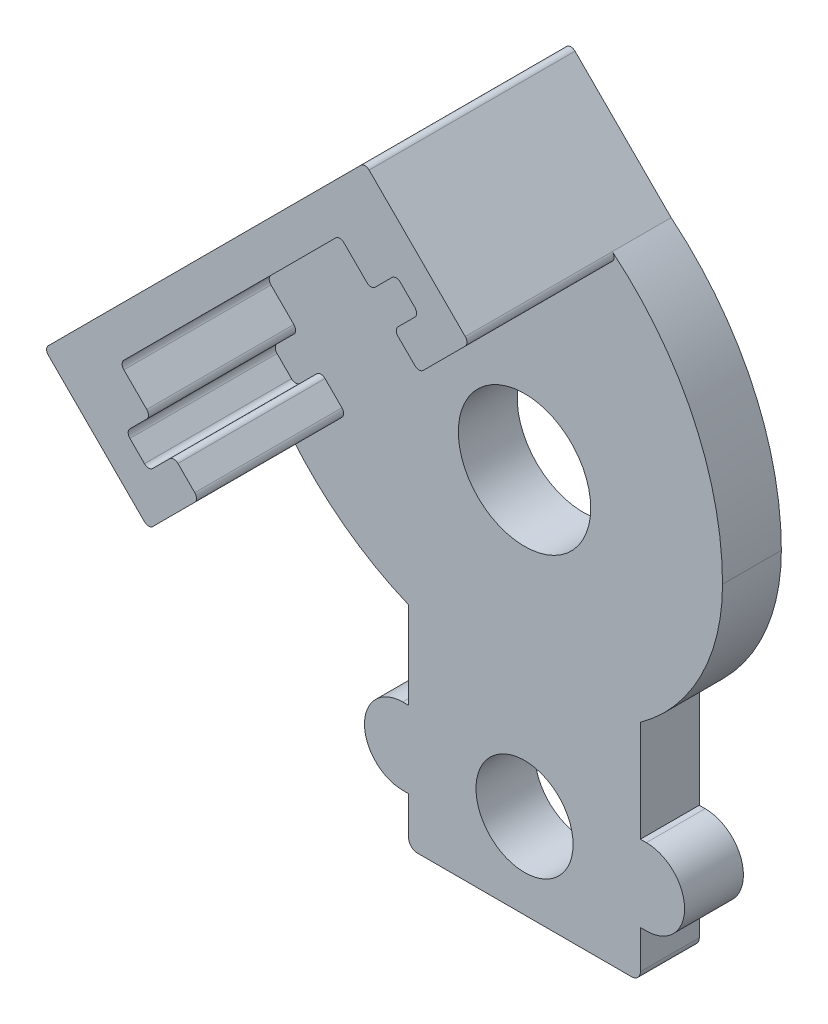
from build123d import *

# Parameters (mm, degrees)
SKETCH1_R           = 2.25
SKETCH1_R_2         = 1.65
BOSS_EXTRUDE1_DEPTH = 2
BOSS_EXTRUDE2_DEPTH = 5


with BuildPart() as part:
    # Sketch1 → Boss-Extrude1 (new body)
    with BuildSketch(Plane.XY):
        with BuildLine():
            Line((-4.14, -8.9), (-3.94, -8.9))
            Line((-3.94, -8.9), (-3.94, -5.942048338))
            ThreePointArc((-3.94, -5.942048338), (-6.111467123, -4.707426407), (-7.919595949, -2.983990617))
            Line((-7.919595949, -2.983990617), (-11.186429278, 0.282842712))
            ThreePointArc((-11.186429278, 0.282842712), (-11.245007922, 0.424264069), (-11.186429278, 0.565685425))
            Line((-11.186429278, 0.565685425), (-0.565685425, 11.186429278))
            ThreePointArc((-0.565685425, 11.186429278), (-0.424264069, 11.245007922), (-0.282842712, 11.186429278))
            Line((-0.282842712, 11.186429278), (2.983990617, 7.919595949))
            ThreePointArc((2.983990617, 7.919595949), (5.746266235, 4.38042767), (6.73, 0))
            ThreePointArc((6.73, 0), (5.992040554, -3.064041449), (3.94, -5.456124999))
            Line((3.94, -5.456124999), (3.94, -8.9))
            Line((3.94, -8.9), (4.14, -8.9))
            ThreePointArc((4.14, -8.9), (5.44, -10.2), (4.14, -11.5))
            Line((4.14, -11.5), (3.94, -11.5))
            Line((3.94, -11.5), (3.94, -12.8))
            ThreePointArc((3.94, -12.8), (3.852132034, -13.012132034), (3.64, -13.1))
            Line((3.64, -13.1), (-3.64, -13.1))
            ThreePointArc((-3.64, -13.1), (-3.852132034, -13.012132034), (-3.94, -12.8))
            Line((-3.94, -12.8), (-3.94, -11.5))
            Line((-3.94, -11.5), (-4.14, -11.5))
            ThreePointArc((-4.14, -11.5), (-5.44, -10.2), (-4.14, -8.9))
        make_face()
        Circle(SKETCH1_R, mode=Mode.SUBTRACT)
        with Locations((0, -10.2)):
            Circle(SKETCH1_R_2, mode=Mode.SUBTRACT)
    extrude(amount=BOSS_EXTRUDE1_DEPTH)

    # Sketch2 → Boss-Extrude2 (add)
    with BuildSketch(Plane.XY.offset(2)):
        with BuildLine():
            Line((0.700035713, 6.781154032), (1.272792206, 6.208397539))
            ThreePointArc((1.272792206, 6.208397539), (1.414213562, 6.149818895), (1.555634919, 6.208397539))
            Line((1.555634919, 6.208397539), (2.983990617, 7.636753237))
            ThreePointArc((2.983990617, 7.636753237), (3.04256926, 7.778174593), (2.983990617, 7.919595949))
            Line((2.983990617, 7.919595949), (-0.282842712, 11.186429278))
            ThreePointArc((-0.282842712, 11.186429278), (-0.424264069, 11.245007922), (-0.565685425, 11.186429278))
            Line((-0.565685425, 11.186429278), (-11.186429278, 0.565685425))
            ThreePointArc((-11.186429278, 0.565685425), (-11.245007922, 0.424264069), (-11.186429278, 0.282842712))
            Line((-11.186429278, 0.282842712), (-7.919595949, -2.983990617))
            ThreePointArc((-7.919595949, -2.983990617), (-7.778174593, -3.04256926), (-7.636753237, -2.983990617))
            Line((-7.636753237, -2.983990617), (-6.208397539, -1.555634919))
            ThreePointArc((-6.208397539, -1.555634919), (-6.149818895, -1.414213562), (-6.208397539, -1.272792206))
            Line((-6.208397539, -1.272792206), (-6.781154032, -0.700035713))
            ThreePointArc((-6.781154032, -0.700035713), (-6.922575388, -0.64145707), (-7.063996744, -0.700035713))
            Line((-7.063996744, -0.700035713), (-7.636753237, -1.272792206))
            ThreePointArc((-7.636753237, -1.272792206), (-7.778174593, -1.33137085), (-7.919595949, -1.272792206))
            Line((-7.919595949, -1.272792206), (-8.414570696, -0.777817459))
            ThreePointArc((-8.414570696, -0.777817459), (-8.47314934, -0.636396103), (-8.414570696, -0.494974747))
            Line((-8.414570696, -0.494974747), (-7.841814203, 0.077781746))
            ThreePointArc((-7.841814203, 0.077781746), (-7.78323556, 0.219203102), (-7.841814203, 0.360624458))
            Line((-7.841814203, 0.360624458), (-8.619631663, 1.138441918))
            ThreePointArc((-8.619631663, 1.138441918), (-8.678210306, 1.279863274), (-8.619631663, 1.42128463))
            Line((-8.619631663, 1.42128463), (-1.42128463, 8.619631663))
            ThreePointArc((-1.42128463, 8.619631663), (-1.279863274, 8.678210306), (-1.138441918, 8.619631663))
            Line((-1.138441918, 8.619631663), (-0.360624458, 7.841814203))
            ThreePointArc((-0.360624458, 7.841814203), (-0.219203102, 7.78323556), (-0.077781746, 7.841814203))
            Line((-0.077781746, 7.841814203), (0.494974747, 8.414570696))
            ThreePointArc((0.494974747, 8.414570696), (0.636396103, 8.47314934), (0.777817459, 8.414570696))
            Line((0.777817459, 8.414570696), (1.272792206, 7.919595949))
            ThreePointArc((1.272792206, 7.919595949), (1.33137085, 7.778174593), (1.272792206, 7.636753237))
            Line((1.272792206, 7.636753237), (0.700035713, 7.063996744))
            ThreePointArc((0.700035713, 7.063996744), (0.64145707, 6.922575388), (0.700035713, 6.781154032))
        make_face()
    extrude(amount=BOSS_EXTRUDE2_DEPTH)


solid = part.part
